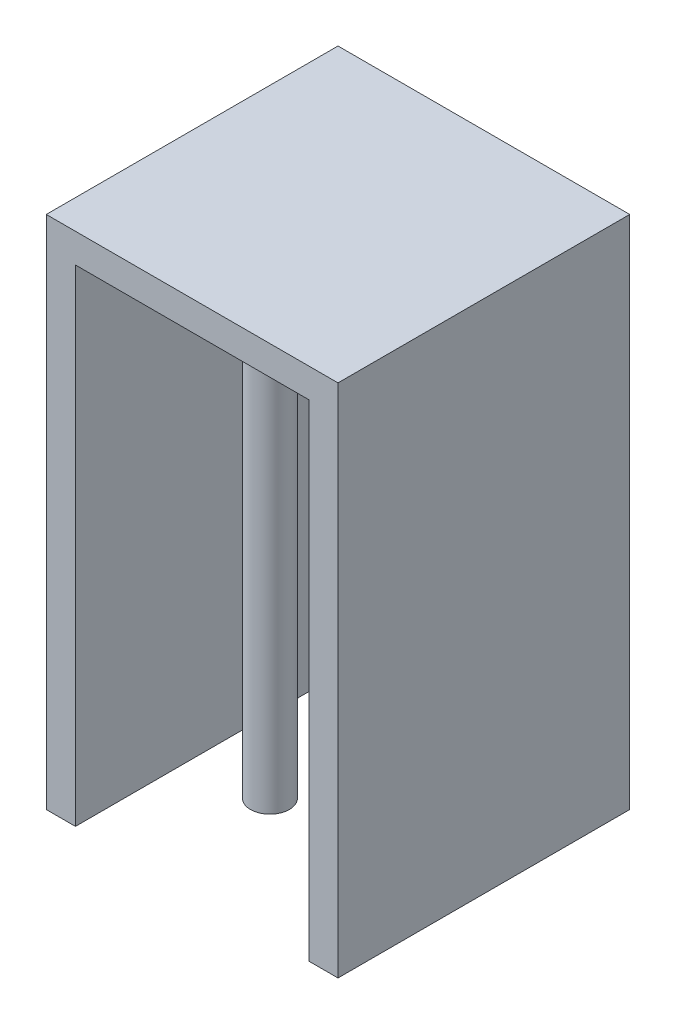
from build123d import *

# Parameters (mm, degrees)
CROQUIS1_W              = 30
CROQUIS1_H              = 30
SALIENTE_EXTRUIR2_DEPTH = 3
SALIENTE_EXTRUIR3_DEPTH = 50
CROQUIS3_R              = 2
SALIENTE_EXTRUIR4_DEPTH = 52.5


with BuildPart() as part:
    # Croquis1 → Saliente-Extruir2 (new body)
    with BuildSketch(Plane(origin=(0, 0, 0), x_dir=(1, 0, 0), z_dir=(0, 1, 0))):
        Rectangle(CROQUIS1_W, CROQUIS1_H)
    extrude(amount=-SALIENTE_EXTRUIR2_DEPTH)

    # Croquis2 → Saliente-Extruir3 (add)
    with BuildSketch(Plane.XZ.offset(3)):
        Polygon((-15, 15), (-12, 15), (-12, -12), (12, -12), (12, 15), (15, 15), (15, -15), (12, -15), (-12, -15), (-15, -15), align=None)
    extrude(amount=SALIENTE_EXTRUIR3_DEPTH)

    # Croquis3 → Saliente-Extruir4 (add)
    with BuildSketch(Plane.XZ.offset(3)):
        with Locations(Location((-7, 0, 0), (0, 0, 90))):
            Circle(CROQUIS3_R)
        with Locations(Location((7, 0, 0), (0, 0, 90))):
            Circle(CROQUIS3_R)
    extrude(amount=SALIENTE_EXTRUIR4_DEPTH)


solid = part.part
